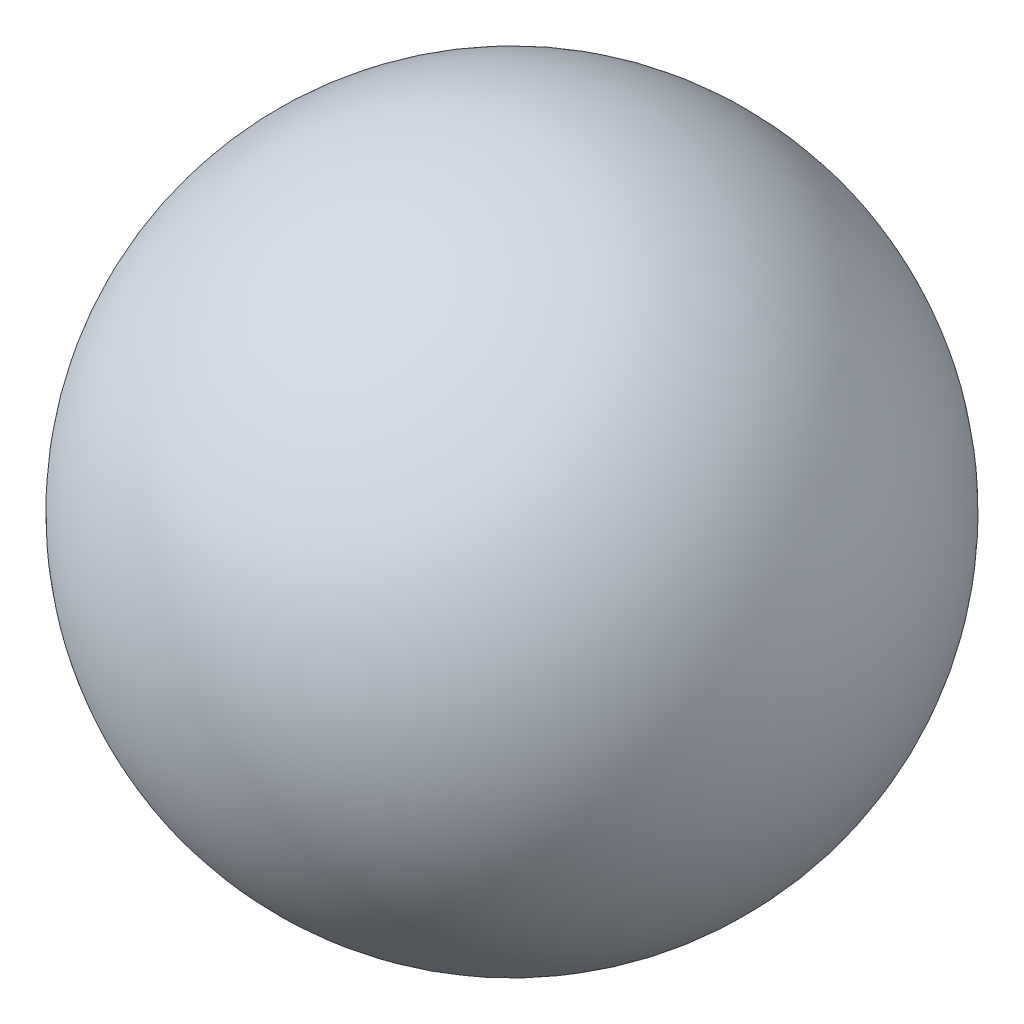
from build123d import *


with BuildPart() as part:
    # Sketch1 → Revolve3 (revolve)
    with BuildSketch(Plane(origin=(0, 0, 0), x_dir=(1, 0, 0), z_dir=(0, 1, 0))):
        with BuildLine():
            Line((0, 4.856495986), (0, -4.856495986))
            ThreePointArc((0, -4.856495986), (4.856495986, 0), (0, 4.856495986))
        make_face()
    revolve(axis=Axis((0, 0, -4.856495986), (0, 0, 1)))


solid = part.part
